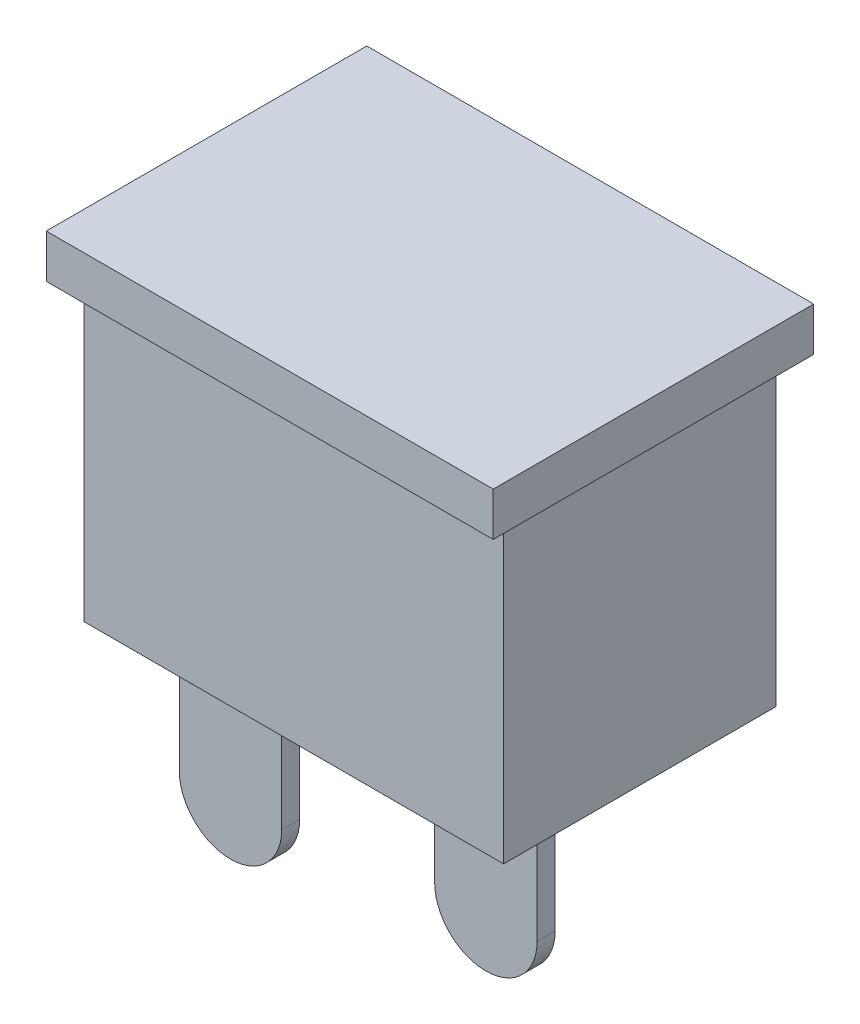
from build123d import *

# Parameters (mm, degrees)
SKETCH1_W           = 19.558
SKETCH1_H           = 12.7
BOSS_EXTRUDE1_DEPTH = 13.97
SKETCH2_W           = 20.828
SKETCH2_H           = 14.9352
BOSS_EXTRUDE2_DEPTH = 2.032
SKETCH3_W           = 4.7752
SKETCH3_H           = 0.8382
BOSS_EXTRUDE3_DEPTH = 8.0772
FILLET1_RADIUS      = 2.3876
FILLET1_LENGTH      = 0.8382
FILLET2_RADIUS      = 2.3876
FILLET2_LENGTH      = 0.8382


with BuildPart() as part:
    # Sketch1 → Boss-Extrude1 (new body)
    with BuildSketch(Plane(origin=(0, 0, 0), x_dir=(1, 0, 0), z_dir=(0, 1, 0))):
        with Locations((9.779, 6.35)):
            Rectangle(SKETCH1_W, SKETCH1_H)
    extrude(amount=-BOSS_EXTRUDE1_DEPTH)

    # Sketch2 → Boss-Extrude2 (add)
    with BuildSketch(Plane(origin=(0, 0, 0), x_dir=(1, 0, 0), z_dir=(0, 1, 0))):
        with Locations((9.779, 6.35)):
            Rectangle(SKETCH2_W, SKETCH2_H)
    extrude(amount=BOSS_EXTRUDE2_DEPTH)

    # Sketch3 → Boss-Extrude3 (add)
    with BuildSketch(Plane.XZ.offset(13.97)):
        with Locations((4.9276, -2.3241)):
            Rectangle(SKETCH3_W, SKETCH3_H)
        with Locations((15.3924, -3.7592)):
            Rectangle(SKETCH3_W, SKETCH3_H)
    extrude(amount=BOSS_EXTRUDE3_DEPTH)

    # Fillet1: full round fillet: the end face becomes a half cylinder, R = half its width
    fillet1_face = Plane((4.9276, -22.0472, -2.3241), x_dir=(0, 0, -1), z_dir=(0, -1, 0))  # on the end face: x along it, z out of the body
    fillet1_slab = fillet1_face.offset(-FILLET1_RADIUS / 2) * Box(FILLET1_LENGTH, 2 * FILLET1_RADIUS, FILLET1_RADIUS, mode=Mode.PRIVATE)  # the body's end, R deep
    fillet1_round = Plane((4.9276, -19.6596, -2.3241), x_dir=(0, -1, 0), z_dir=(0, 0, -1)) * Cylinder(FILLET1_RADIUS, FILLET1_LENGTH, mode=Mode.PRIVATE)  # its axis R under the face
    add(fillet1_slab - fillet1_round, mode=Mode.SUBTRACT)

    # Fillet2: full round fillet: the end face becomes a half cylinder, R = half its width
    fillet2_face = Plane((15.3924, -22.0472, -3.7592), x_dir=(0, 0, -1), z_dir=(0, -1, 0))  # on the end face: x along it, z out of the body
    fillet2_slab = fillet2_face.offset(-FILLET2_RADIUS / 2) * Box(FILLET2_LENGTH, 2 * FILLET2_RADIUS, FILLET2_RADIUS, mode=Mode.PRIVATE)  # the body's end, R deep
    fillet2_round = Plane((15.3924, -19.6596, -3.7592), x_dir=(0, -1, 0), z_dir=(0, 0, -1)) * Cylinder(FILLET2_RADIUS, FILLET2_LENGTH, mode=Mode.PRIVATE)  # its axis R under the face
    add(fillet2_slab - fillet2_round, mode=Mode.SUBTRACT)


solid = part.part
